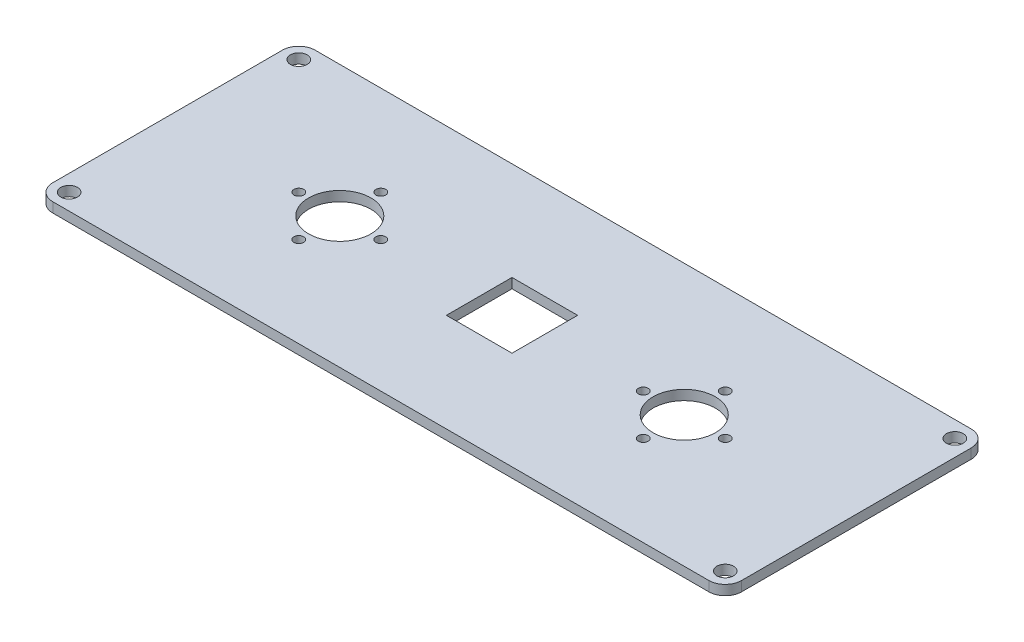
from build123d import *

# Parameters (mm, degrees)
SKETCH1_W               = 210
SKETCH1_H               = 80
SKETCH1_R               = 1.5
SKETCH1_R_2             = 9.5
SKETCH1_W_2             = 20
SKETCH1_H_2             = 20
BOSS_EXTRUDE1_DEPTH     = 3
FILLET1_R               = 5
F_1_4_20_TAPPED_HOLE1_D = 5.1054


with BuildPart() as part:
    # Sketch1 → Boss-Extrude1 (new body)
    with BuildSketch(Plane(origin=(0, 0, 0), x_dir=(1, 0, 0), z_dir=(0, 1, 0))):
        with Locations((105, 40)):
            Rectangle(SKETCH1_W, SKETCH1_H)
        with Locations(Location((52.5, 52.5, 0), (0, 0, 270))):
            Circle(SKETCH1_R, mode=Mode.SUBTRACT)
        with Locations(Location((65, 40, 0), (0, 0, 270))):
            Circle(SKETCH1_R, mode=Mode.SUBTRACT)
        with Locations(Location((52.5, 27.5, 0), (0, 0, 270))):
            Circle(SKETCH1_R, mode=Mode.SUBTRACT)
        with Locations(Location((40, 40, 0), (0, 0, 270))):
            Circle(SKETCH1_R, mode=Mode.SUBTRACT)
        with Locations(Location((157.5, 52.5, 0), (0, 0, 270))):
            Circle(SKETCH1_R, mode=Mode.SUBTRACT)
        with Locations(Location((170, 40, 0), (0, 0, 270))):
            Circle(SKETCH1_R, mode=Mode.SUBTRACT)
        with Locations(Location((157.5, 27.5, 0), (0, 0, 270))):
            Circle(SKETCH1_R, mode=Mode.SUBTRACT)
        with Locations(Location((145, 40, 0), (0, 0, 270))):
            Circle(SKETCH1_R, mode=Mode.SUBTRACT)
        with Locations(Location((52.5, 40, 0), (0, 0, 270))):
            Circle(SKETCH1_R_2, mode=Mode.SUBTRACT)
        with Locations(Location((157.5, 40, 0), (0, 0, 270))):
            Circle(SKETCH1_R_2, mode=Mode.SUBTRACT)
        with Locations((105, 40)):
            Rectangle(SKETCH1_W_2, SKETCH1_H_2, mode=Mode.SUBTRACT)
    extrude(amount=-BOSS_EXTRUDE1_DEPTH)

    # Fillet1
    fillet1_edges = [part.edges().sort_by_distance(p)[0] for p in [
        (0, -1.5, -80),
        (210, -1.5, -80),
        (210, -1.5, 0),
        (0, -1.5, 0),
    ]]
    fillet(fillet1_edges, radius=FILLET1_R)

    # 1/4-20 Tapped Hole1 (through all)
    with Locations(Plane(origin=(0, 0, 0), x_dir=(1, 0, 0), z_dir=(0, 1, 0))):
        with Locations((5, 75), (5, 5), (205, 5), (205, 75)):
            Hole(F_1_4_20_TAPPED_HOLE1_D / 2)


solid = part.part
